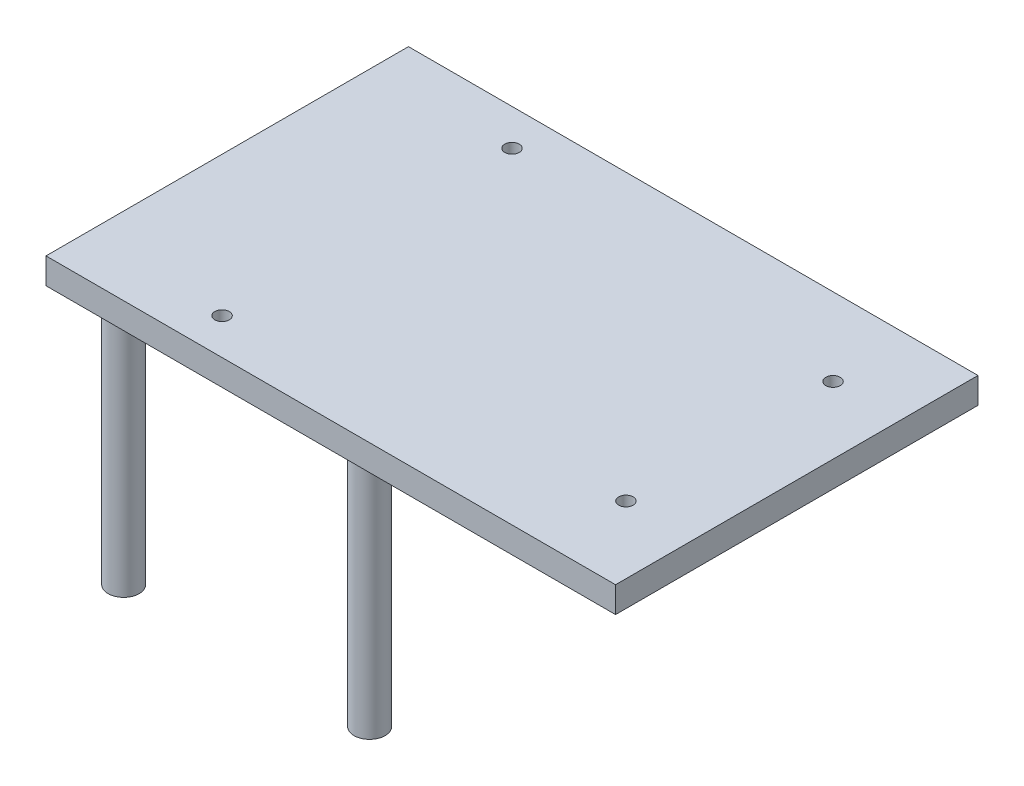
from build123d import *

# Parameters (mm, degrees)
SKETCH1_W           = 110
SKETCH1_H           = 70
BOSS_EXTRUDE2_DEPTH = 5
SKETCH2_R           = 1.4
CUT_EXTRUDE1_DEPTH  = 5
SKETCH4_R           = 3
BOSS_EXTRUDE3_DEPTH = 50
SKETCH5_R           = 1.4
CUT_EXTRUDE2_DEPTH  = 3


with BuildPart() as part:
    # Sketch1 → Boss-Extrude2 (new body)
    with BuildSketch(Plane(origin=(0, 0, 0), x_dir=(1, 0, 0), z_dir=(0, 1, 0))):
        Rectangle(SKETCH1_W, SKETCH1_H)
    extrude(amount=-BOSS_EXTRUDE2_DEPTH)

    # Sketch2 → Cut-Extrude1 (cut)
    with BuildSketch(Plane(origin=(0, 0, 0), x_dir=(1, 0, 0), z_dir=(0, 1, 0))):
        with Locations(Location((-28, 28, 0), (0, 0, 270))):
            Circle(SKETCH2_R)
        with Locations(Location((42, 20, 0), (0, 0, 270))):
            Circle(SKETCH2_R)
        with Locations(Location((-28, -28, 0), (0, 0, 270))):
            Circle(SKETCH2_R)
        with Locations(Location((42, -20, 0), (0, 0, 270))):
            Circle(SKETCH2_R)
    extrude(amount=-CUT_EXTRUDE1_DEPTH, mode=Mode.SUBTRACT)

    # Sketch4 → Boss-Extrude3 (add)
    with BuildSketch(Plane.XZ.offset(5)):
        with Locations(Location((-47.5, 27.5, 0), (0, 0, 90))):
            Circle(SKETCH4_R)
        with Locations(Location((0, 27.5, 0), (0, 0, 90))):
            Circle(SKETCH4_R)
        with Locations(Location((0, -27.5, 0), (0, 0, 90))):
            Circle(SKETCH4_R)
        with Locations(Location((-47.5, -27.5, 0), (0, 0, 90))):
            Circle(SKETCH4_R)
    extrude(amount=BOSS_EXTRUDE3_DEPTH)

    # Sketch5 → Cut-Extrude2 (cut)
    with BuildSketch(Plane.XZ.offset(55)):
        with Locations(Location((-47.5, 27.5, 0), (0, 0, 270))):
            Circle(SKETCH5_R)
        with Locations(Location((0, 27.5, 0), (0, 0, 270))):
            Circle(SKETCH5_R)
        with Locations(Location((0, -27.5, 0), (0, 0, 90))):
            Circle(SKETCH5_R)
        with Locations(Location((-47.5, -27.5, 0), (0, 0, 90))):
            Circle(SKETCH5_R)
    extrude(amount=-CUT_EXTRUDE2_DEPTH, mode=Mode.SUBTRACT)


solid = part.part
